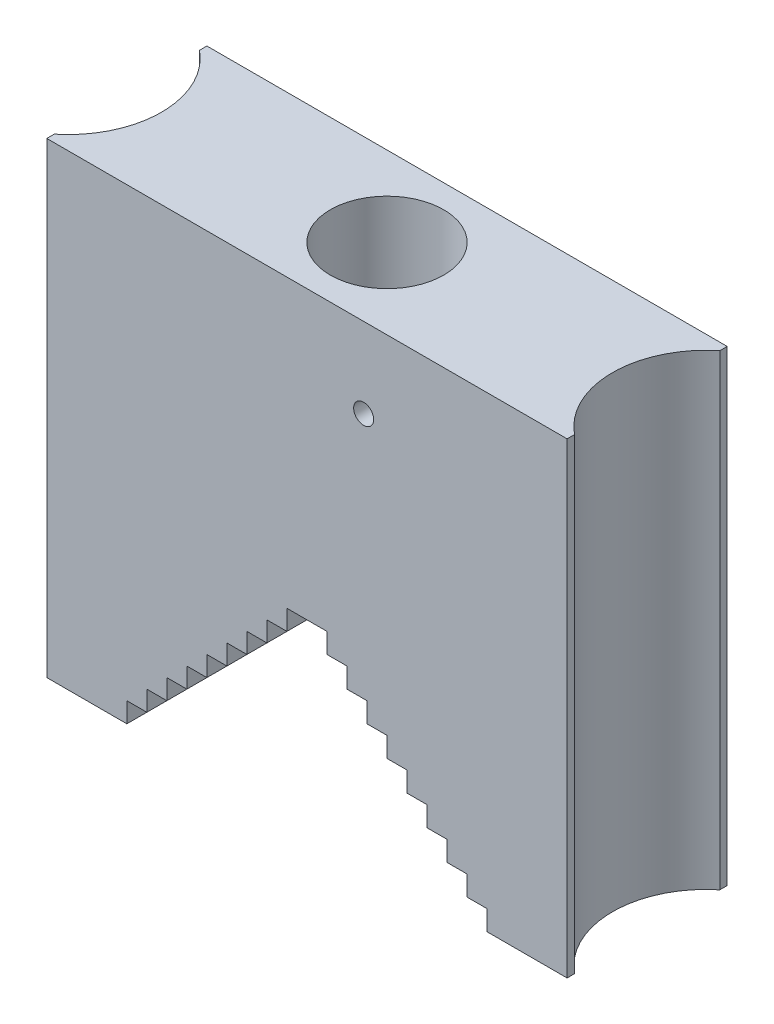
from build123d import *

# Parameters (mm, degrees)
SKETCH1_W                      = 78
SKETCH1_H                      = 70
BOSS_EXTRUDE1_DEPTH            = 12
F_17_0_17_DIAMETER_HOLE1_D     = 17
F_17_0_17_DIAMETER_HOLE1_DEPTH = 25
F_17_0_17_DIAMETER_HOLE1_TIP   = 5.107315262
F_3_0_3_DIAMETER_HOLE1_D       = 3
CUT_EXTRUDE1_REACH             = 83.025
SKETCH8_R                      = 14
CUT_EXTRUDE2_DEPTH             = 58.636793906


with BuildPart() as part:
    # Sketch1 → Boss-Extrude1 (new, symmetric)
    with BuildSketch(Plane.XY):
        Rectangle(SKETCH1_W, SKETCH1_H)
    extrude(amount=BOSS_EXTRUDE1_DEPTH, both=True)

    # Ø17.0 (17) Diameter Hole1
    with Locations(Plane(origin=(0, 35, 0), x_dir=(1, 0, 0), z_dir=(0, 1, 0))):
        with Locations((0, 0)):
            Hole(F_17_0_17_DIAMETER_HOLE1_D / 2, depth=F_17_0_17_DIAMETER_HOLE1_DEPTH)
            with Locations((0, 0, -(F_17_0_17_DIAMETER_HOLE1_DEPTH + F_17_0_17_DIAMETER_HOLE1_TIP / 2))):  # 118° drill point
                Cone(0, F_17_0_17_DIAMETER_HOLE1_D / 2, F_17_0_17_DIAMETER_HOLE1_TIP, mode=Mode.SUBTRACT)

    # Ø3.0 (3) Diameter Hole1 (through all)
    with Locations(Plane.XY.offset(12)):
        with Locations((8.5, 23)):
            Hole(F_3_0_3_DIAMETER_HOLE1_D / 2)

    # Sketch8 → Cut-Extrude1 (cut, up to next)
    with BuildSketch(Plane(origin=(0, 35, 0), x_dir=(1, 0, 0), z_dir=(0, 1, 0)), mode=Mode.PRIVATE) as cut_extrude1_sk1:
        with Locations((-47.8, 0)):
            Circle(SKETCH8_R)
    cut_extrude1_tool1 = extrude(cut_extrude1_sk1.sketch, amount=-CUT_EXTRUDE1_REACH, mode=Mode.PRIVATE) & part.part
    # Sketch8 → Cut-Extrude1 (cut, up to next)
    with BuildSketch(Plane(origin=(0, 35, 0), x_dir=(1, 0, 0), z_dir=(0, 1, 0)), mode=Mode.PRIVATE) as cut_extrude1_sk2:
        with Locations((47.8, 0)):
            Circle(SKETCH8_R)
    cut_extrude1_tool2 = extrude(cut_extrude1_sk2.sketch, amount=-CUT_EXTRUDE1_REACH, mode=Mode.PRIVATE) & part.part
    add(cut_extrude1_tool1.solids().sort_by_distance((-47.8, 35, 0))[0], mode=Mode.SUBTRACT)
    add(cut_extrude1_tool2.solids().sort_by_distance((47.8, 35, 0))[0], mode=Mode.SUBTRACT)

    # Sketch9 → Cut-Extrude2 (cut, through all)
    with BuildSketch(Plane.XY.offset(12)):
        Polygon((-27, -35), (27, -35), (27, -32), (24, -32), (24, -29), (21, -29), (21, -26), (18, -26), (18, -23), (15, -23), (15, -20), (12, -20), (12, -17), (9, -17), (9, -14), (6, -14), (6, -11), (3, -11), (3, -8), (0, -8), (-3, -8), (-3, -11), (-6, -11), (-6, -14), (-9, -14), (-9, -17), (-12, -17), (-12, -20), (-15, -20), (-15, -23), (-18, -23), (-18, -26), (-21, -26), (-21, -29), (-24, -29), (-24, -32), (-27, -32), align=None)
    extrude(amount=-CUT_EXTRUDE2_DEPTH, mode=Mode.SUBTRACT)


solid = part.part
